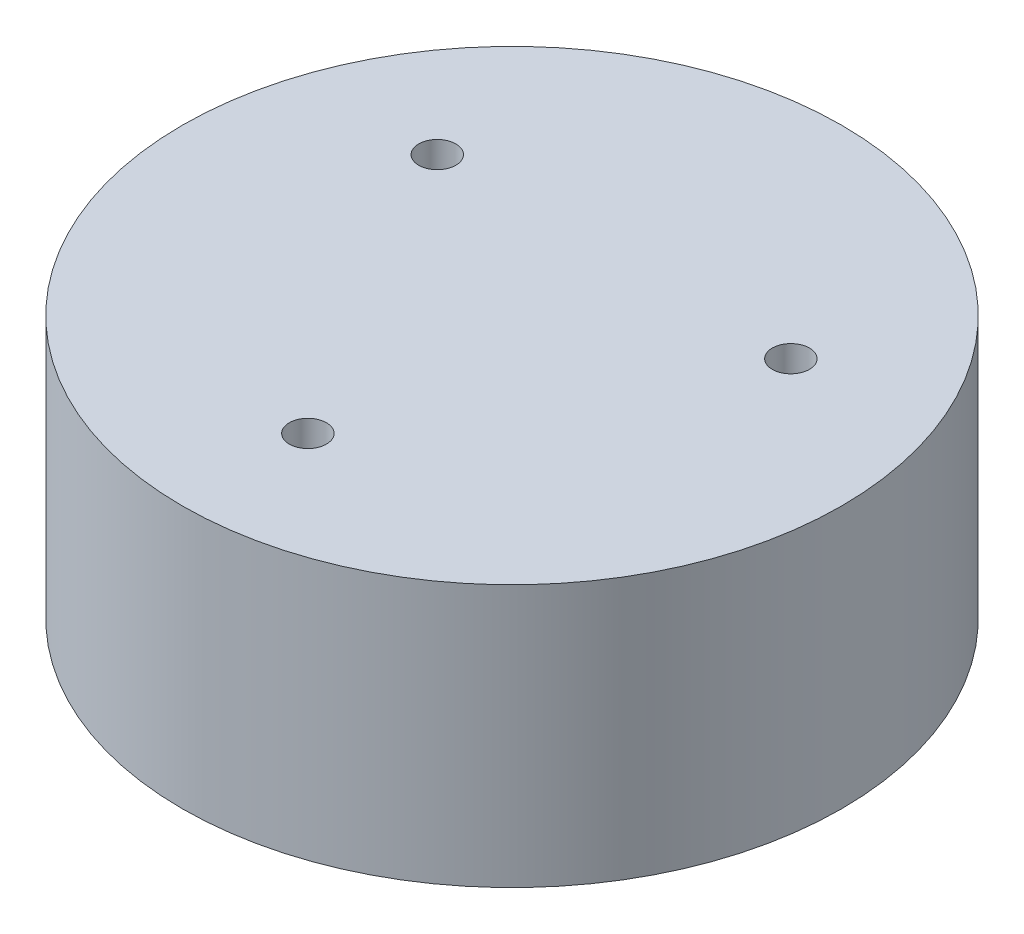
from build123d import *

# Parameters (mm, degrees)
SKETCH1_R           = 26.65
BOSS_EXTRUDE1_DEPTH = 21.2
SKETCH6_R           = 1.5
CUT_EXTRUDE2_DEPTH  = 8.255
SKETCH7_R           = 1.5
CUT_EXTRUDE3_DEPTH  = 10


with BuildPart() as part:
    # Sketch1 → Boss-Extrude1 (new body)
    with BuildSketch(Plane(origin=(0, 0, 0), x_dir=(1, 0, 0), z_dir=(0, 1, 0))):
        with Locations(Location((0, 0, 0), (0, 0, 270))):
            Circle(SKETCH1_R)
    extrude(amount=BOSS_EXTRUDE1_DEPTH)

    # Sketch6 → Cut-Extrude2 (cut)
    with BuildSketch(Plane(origin=(0, 0, 0), x_dir=(-1, 0, 0), z_dir=(0, -1, 0))):
        with Locations(Location((6.313805851, -15.242875716, 0), (0, 0, 90))):
            Circle(SKETCH6_R)
        with Locations(Location((-16.357620523, 2.153521596, 0), (0, 0, 90))):
            Circle(SKETCH6_R)
        with Locations(Location((10.043814672, 13.08935412, 0), (0, 0, 90))):
            Circle(SKETCH6_R)
    extrude(amount=-CUT_EXTRUDE2_DEPTH, mode=Mode.SUBTRACT)

    # Sketch7 → Cut-Extrude3 (cut)
    with BuildSketch(Plane(origin=(0, 21.2, 0), x_dir=(1, 0, 0), z_dir=(0, 1, 0))):
        with Locations(Location((0, -16.5, 0), (0, 0, 270))):
            Circle(SKETCH7_R)
        with Locations(Location((-14.289419162, 8.25, 0), (0, 0, 270))):
            Circle(SKETCH7_R)
        with Locations(Location((14.289419162, 8.25, 0), (0, 0, 270))):
            Circle(SKETCH7_R)
    extrude(amount=-CUT_EXTRUDE3_DEPTH, mode=Mode.SUBTRACT)


solid = part.part
